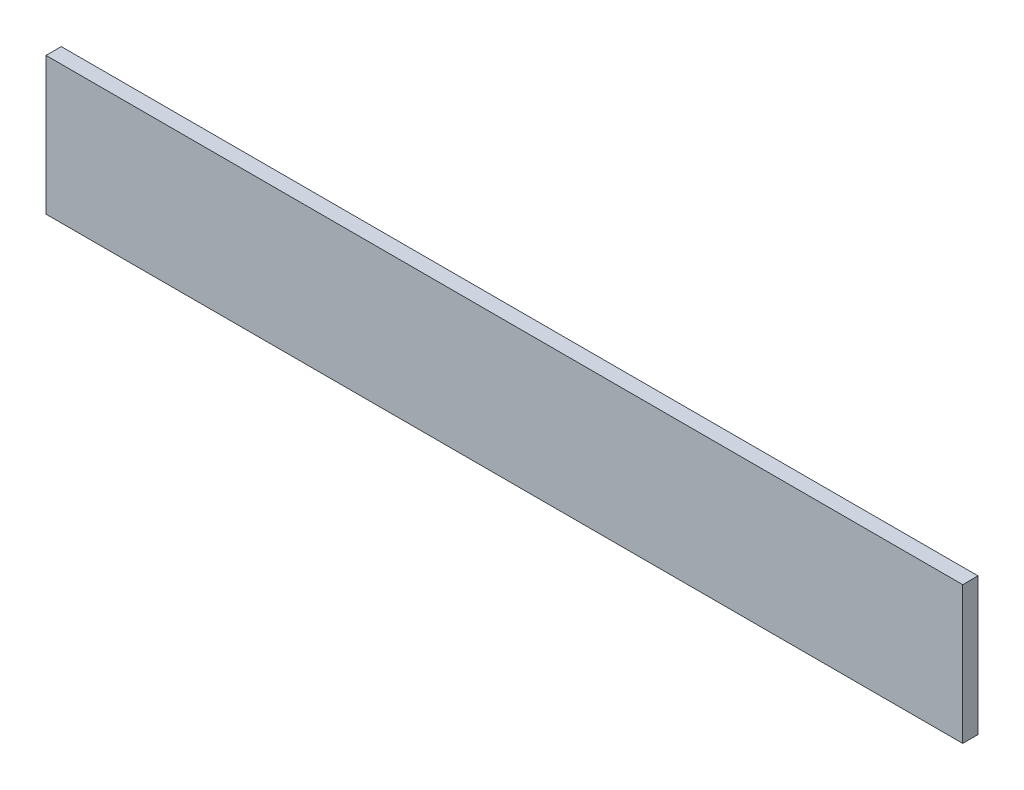
from build123d import *

# Parameters (mm, degrees)
SKETCH1_W           = 300
SKETCH1_H           = 45
BOSS_EXTRUDE1_DEPTH = 5


with BuildPart() as part:
    # Sketch1 → Boss-Extrude1 (new body)
    with BuildSketch(Plane.XY):
        with Locations((150, -22.5)):
            Rectangle(SKETCH1_W, SKETCH1_H)
    extrude(amount=BOSS_EXTRUDE1_DEPTH)


solid = part.part
